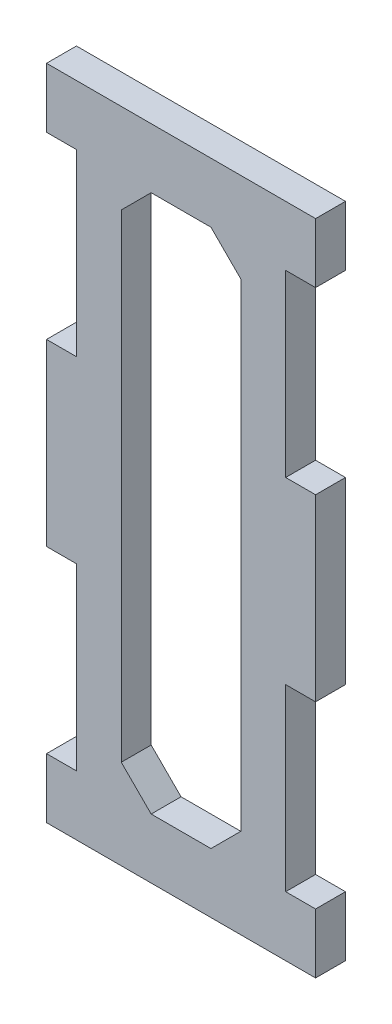
from build123d import *

# Parameters (mm, degrees)
BOSS_EXTRU_1_DEPTH      = 10
ENL_V_MAT_EXTRU_1_DEPTH = 10


with BuildPart() as part:
    # Esquisse1 → Boss.-Extru.1 (new body)
    with BuildSketch(Plane.XY):
        Polygon((0, 0), (90, 0), (90, 20), (80, 20), (80, 80), (90, 80), (90, 140), (80, 140), (80, 200), (90, 200), (90, 220), (0, 220), (0, 200), (10, 200), (10, 140), (0, 140), (0, 80), (10, 80), (10, 20), (0, 20), align=None)
    extrude(amount=BOSS_EXTRU_1_DEPTH)

    # Esquisse2 → Enlèv. mat.-Extru.1 (cut)
    with BuildSketch(Plane.XY.offset(10)):
        Polygon((35, 200), (55, 200), (65, 190), (65, 30), (55, 20), (35, 20), (25, 30), (25, 190), align=None)
    extrude(amount=-ENL_V_MAT_EXTRU_1_DEPTH, mode=Mode.SUBTRACT)


solid = part.part
